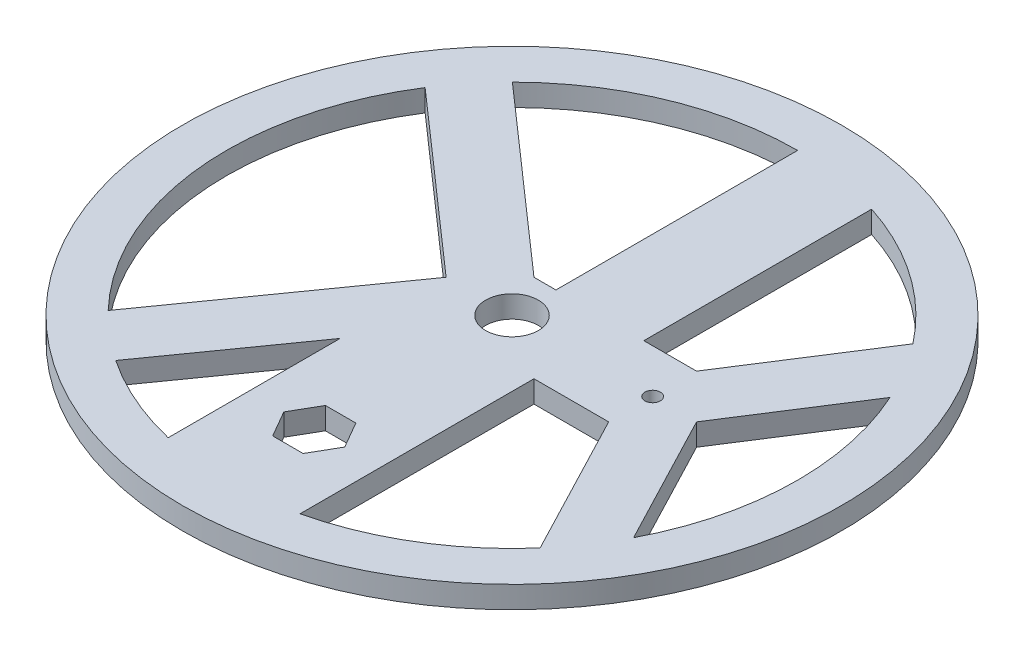
from build123d import *

# Parameters (mm, degrees)
SKETCH1_R           = 75
SKETCH1_R_2         = 1.75
SKETCH1_R_3         = 6
BOSS_EXTRUDE1_DEPTH = 5
CUT_EXTRUDE1_DEPTH  = 107.183802908


with BuildPart() as part:
    # Sketch1 → Boss-Extrude1 (new body)
    with BuildSketch(Plane(origin=(0, 0, 0), x_dir=(1, 0, 0), z_dir=(0, 1, 0))):
        Circle(SKETCH1_R)
        with Locations((32, 0)):
            Circle(SKETCH1_R_2, mode=Mode.SUBTRACT)
        Circle(SKETCH1_R_3, mode=Mode.SUBTRACT)
        Polygon((3.464101615, -51), (6.92820323, -45), (3.464101615, -39), (-3.464101615, -39), (-6.92820323, -45), (-3.464101615, -51), align=None, mode=Mode.SUBTRACT)
    extrude(amount=BOSS_EXTRUDE1_DEPTH)

    # Sketch2 → Cut-Extrude1 (cut, through all)
    with BuildSketch(Plane(origin=(0, 5, 0), x_dir=(1, 0, 0), z_dir=(0, 1, 0))):
        with BuildLine():
            Line((-45.916707554, 46.007129527), (-5, 10))
            Line((-5, 10), (0, 10))
            Line((0, 10), (0, 65))
            ThreePointArc((0, 65), (-24.844884591, 60.064396356), (-45.916707554, 46.007129527))
        make_face()
        with BuildLine():
            Line((-46.904157598, -45), (-15, 0))
            Line((-15, 0), (-54.772255751, 35))
            ThreePointArc((-54.772255751, 35), (-64.687891122, -6.362133458), (-46.904157598, -45))
        make_face()
        with BuildLine():
            Line((20, 61.846584384), (20, 10))
            Line((20, 10), (32, 10))
            Line((32, 10), (51.23475383, 40))
            ThreePointArc((51.23475383, 40), (37.254742659, 53.264285871), (20, 61.846584384))
        make_face()
        with BuildLine():
            Line((-15, -24.104744769), (-36.190322049, -53.993153177))
            ThreePointArc((-36.190322049, -53.993153177), (-26.00988263, -59.569169925), (-15, -63.245553203))
            Line((-15, -63.245553203), (-15, -24.104744769))
        make_face()
        with BuildLine():
            Line((32, -10), (15, -10))
            Line((15, -10), (15, -63.245553203))
            ThreePointArc((15, -63.245553203), (33.63849917, -55.618804137), (49.048013306, -42.653163901))
            Line((49.048013306, -42.653163901), (32, -10))
        make_face()
        with BuildLine():
            Line((59.203473805, 26.831859597), (42, 0))
            Line((42, 0), (57.662812973, -30))
            ThreePointArc((57.662812973, -30), (64.976128791, -1.761444678), (59.203473805, 26.831859597))
        make_face()
    extrude(amount=-CUT_EXTRUDE1_DEPTH, mode=Mode.SUBTRACT)


solid = part.part
